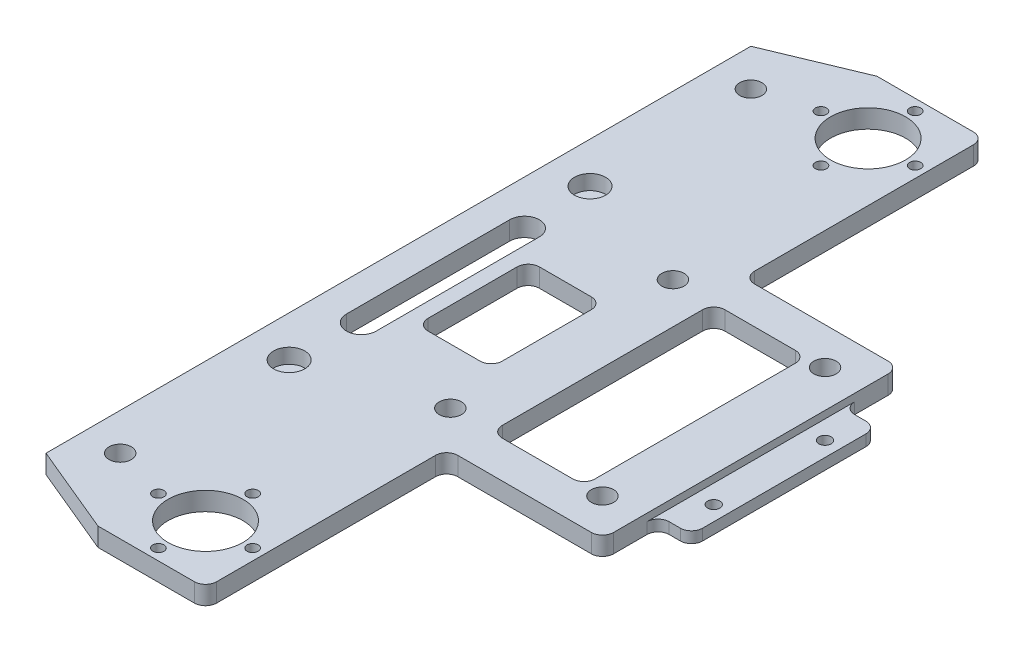
from build123d import *

# Parameters (mm, degrees)
ESQUISSE1_R                                   = 3
ESQUISSE1_R_2                                 = 10.1
ESQUISSE1_R_3                                 = 1.5
ESQUISSE1_W                                   = 25
ESQUISSE1_H                                   = 60
ESQUISSE1_W_2                                 = 20
ESQUISSE1_H_2                                 = 30
BOSS_EXTRU_1_DEPTH                            = 5
CONG_1_R                                      = 3
ESQUISSE3_R                                   = 4.2
ENL_V_MAT_EXTRU_2_DEPTH                       = 4
ESQUISSE4_W                                   = 9
ESQUISSE4_H                                   = 56
ENL_V_MAT_EXTRU_3_DEPTH                       = 2
TROU_POUR_TARAUDAGE_POUR_TROU_TARAUD_M4_D     = 3.3
TROU_POUR_TARAUDAGE_POUR_TROU_TARAUD_M4_DEPTH = 10
TROU_POUR_TARAUDAGE_POUR_TROU_TARAUD_M4_TIP   = 0.991420021


with BuildPart() as part:
    # Esquisse1 → Boss.-Extru.1 (new body)
    with BuildSketch(Plane(origin=(0, 0, 0), x_dir=(1, 0, 0), z_dir=(0, 1, 0))):
        Polygon((-104, 95), (-104, -95), (-80, -105), (-51, -105), (-51, -40), (-9, -40), (-9, -25), (0, -25), (0, 25), (-9, 25), (-9, 40), (-51, 40), (-51, 105), (-80, 105), align=None)
        with Locations(Location((-60, 30, 0), (0, 0, 270))):
            Circle(ESQUISSE1_R, mode=Mode.SUBTRACT)
        with Locations(Location((-60, -30, 0), (0, 0, 270))):
            Circle(ESQUISSE1_R, mode=Mode.SUBTRACT)
        with Locations(Location((-19, -30, 0), (0, 0, 270))):
            Circle(ESQUISSE1_R, mode=Mode.SUBTRACT)
        with Locations(Location((-19, 30, 0), (0, 0, 270))):
            Circle(ESQUISSE1_R, mode=Mode.SUBTRACT)
        with Locations(Location((-94, 85, 0), (0, 0, 270))):
            Circle(ESQUISSE1_R, mode=Mode.SUBTRACT)
        with Locations(Location((-94, -85, 0), (0, 0, 270))):
            Circle(ESQUISSE1_R, mode=Mode.SUBTRACT)
        with Locations(Location((-66.7, 89.3, 0), (0, 0, 270))):
            Circle(ESQUISSE1_R_2, mode=Mode.SUBTRACT)
        with Locations(Location((-54, 89.3, 0), (0, 0, 270))):
            Circle(ESQUISSE1_R_3, mode=Mode.SUBTRACT)
        with Locations(Location((-66.7, 102, 0), (0, 0, 270))):
            Circle(ESQUISSE1_R_3, mode=Mode.SUBTRACT)
        with Locations(Location((-79.4, 89.3, 0), (0, 0, 270))):
            Circle(ESQUISSE1_R_3, mode=Mode.SUBTRACT)
        with Locations(Location((-66.7, 76.6, 0), (0, 0, 270))):
            Circle(ESQUISSE1_R_3, mode=Mode.SUBTRACT)
        with Locations(Location((-66.7, -89.3, 0), (0, 0, 270))):
            Circle(ESQUISSE1_R_2, mode=Mode.SUBTRACT)
        with Locations(Location((-54, -89.3, 0), (0, 0, 270))):
            Circle(ESQUISSE1_R_3, mode=Mode.SUBTRACT)
        with Locations(Location((-66.7, -76.6, 0), (0, 0, 270))):
            Circle(ESQUISSE1_R_3, mode=Mode.SUBTRACT)
        with Locations(Location((-79.4, -89.3, 0), (0, 0, 270))):
            Circle(ESQUISSE1_R_3, mode=Mode.SUBTRACT)
        with Locations(Location((-66.7, -102, 0), (0, 0, 270))):
            Circle(ESQUISSE1_R_3, mode=Mode.SUBTRACT)
        with Locations((-36.5, 0)):
            Rectangle(ESQUISSE1_W, ESQUISSE1_H, mode=Mode.SUBTRACT)
        with BuildLine():
            Line((-88, 22), (-88, -22))
            ThreePointArc((-88, -22), (-92, -26), (-96, -22))
            Line((-96, -22), (-96, 22))
            ThreePointArc((-96, 22), (-92, 26), (-88, 22))
        make_face(mode=Mode.SUBTRACT)
        with Locations((-74, 0)):
            Rectangle(ESQUISSE1_W_2, ESQUISSE1_H_2, mode=Mode.SUBTRACT)
    extrude(amount=BOSS_EXTRU_1_DEPTH)

    # Congé1
    cong_1_edges = [part.edges().sort_by_distance(p)[0] for p in [
        (-51, 2.5, -105),
        (-51, 2.5, -40),
        (-9, 2.5, -40),
        (-9, 2.5, -25),
        (0, 2.5, -25),
        (0, 2.5, 25),
        (-9, 2.5, 25),
        (-9, 2.5, 40),
        (-51, 2.5, 40),
        (-51, 2.5, 105),
        (-49, 2.5, -30),
        (-49, 2.5, 30),
        (-24, 2.5, 30),
        (-24, 2.5, -30),
        (-84, 2.5, -15),
        (-84, 2.5, 15),
        (-64, 2.5, 15),
        (-64, 2.5, -15),
    ]]
    fillet(cong_1_edges, radius=CONG_1_R)

    # Esquisse3 → Enlèv. mat.-Extru.2 (cut)
    with BuildSketch(Plane(origin=(0, 5, 0), x_dir=(1, 0, 0), z_dir=(0, 1, 0))):
        with Locations(Location((-93, 40.65, 0), (0, 0, 270))):
            Circle(ESQUISSE3_R)
        with Locations(Location((-93, -40.45, 0), (0, 0, 270))):
            Circle(ESQUISSE3_R)
    extrude(amount=-ENL_V_MAT_EXTRU_2_DEPTH, mode=Mode.SUBTRACT)

    # Esquisse4 → Enlèv. mat.-Extru.3 (cut)
    with BuildSketch(Plane(origin=(0, 5, 0), x_dir=(1, 0, 0), z_dir=(0, 1, 0))):
        with Locations((-4.5, 0)):
            Rectangle(ESQUISSE4_W, ESQUISSE4_H)
    extrude(amount=-ENL_V_MAT_EXTRU_3_DEPTH, mode=Mode.SUBTRACT)

    # Trou pour taraudage pour trou taraudé M41
    with Locations(Plane(origin=(0, 3, 0), x_dir=(1, 0, 0), z_dir=(0, 1, 0))):
        with Locations((-4, 15), (-4, -15)):
            Hole(TROU_POUR_TARAUDAGE_POUR_TROU_TARAUD_M4_D / 2, depth=TROU_POUR_TARAUDAGE_POUR_TROU_TARAUD_M4_DEPTH)
            with Locations((0, 0, -(TROU_POUR_TARAUDAGE_POUR_TROU_TARAUD_M4_DEPTH + TROU_POUR_TARAUDAGE_POUR_TROU_TARAUD_M4_TIP / 2))):  # 118° drill point
                Cone(0, TROU_POUR_TARAUDAGE_POUR_TROU_TARAUD_M4_D / 2, TROU_POUR_TARAUDAGE_POUR_TROU_TARAUD_M4_TIP, mode=Mode.SUBTRACT)


solid = part.part
